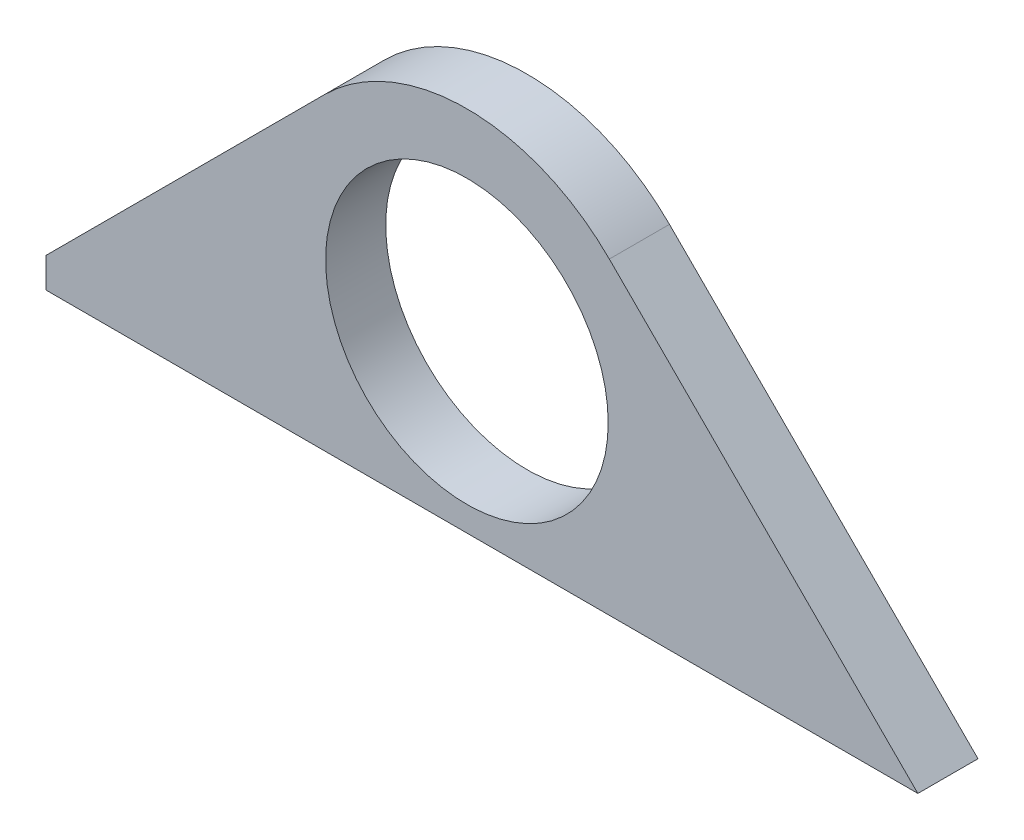
from build123d import *

# Parameters (mm, degrees)
ESQUISSE1_R        = 23.5
BOSS_EXTRU_1_DEPTH = 10


with BuildPart() as part:
    # Esquisse1 → Boss.-Extru.1 (new body)
    with BuildSketch(Plane.XY):
        with BuildLine():
            Line((0, 0), (140, 0))
            Line((140, 0), (145, 0))
            Line((145, 0), (140, 5))
            Line((140, 5), (93.68807717, 51.31192283))
            ThreePointArc((93.68807717, 51.31192283), (70, 61.123845661), (46.31192283, 51.31192283))
            Line((46.31192283, 51.31192283), (0, 5))
            Line((0, 5), (0, 0))
        make_face()
        with Locations((70, 27.623845661)):
            Circle(ESQUISSE1_R, mode=Mode.SUBTRACT)
    extrude(amount=BOSS_EXTRU_1_DEPTH)


solid = part.part
